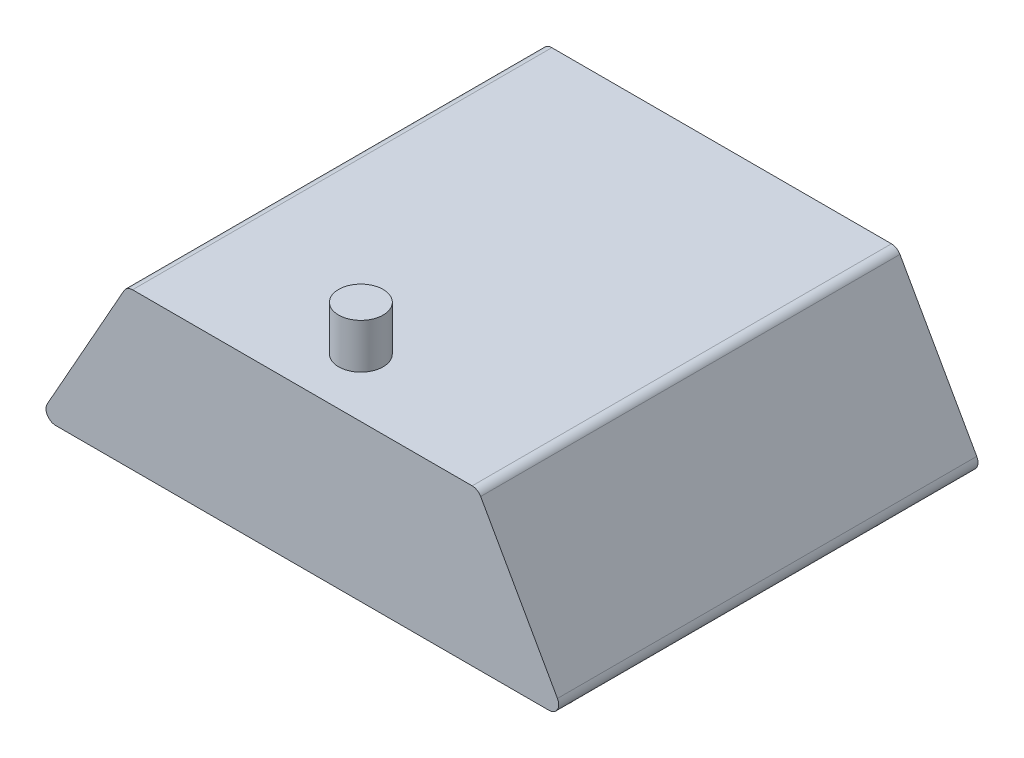
from build123d import *

# Parameters (mm, degrees)
BOSS_EXTRUDE1_DEPTH           = 215
SKETCH2_R                     = 11.405
BOSS_EXTRUDE2_DEPTH           = 20
SKETCH4_R                     = 12.5
BOSS_EXTRUDE3_DEPTH           = 20
BOSS_EXTRUDE3_DRAFT           = 11
BOSS_EXTRUDE3_PROFILE_2_DEPTH = 20
BOSS_EXTRUDE3_PROFILE_2_DRAFT = 11
BOSS_EXTRUDE3_PROFILE_3_DEPTH = 20
BOSS_EXTRUDE3_PROFILE_3_DRAFT = 11
BOSS_EXTRUDE3_PROFILE_4_DEPTH = 20
BOSS_EXTRUDE3_PROFILE_4_DRAFT = 11
SKETCH5_R                     = 11.405
BOSS_EXTRUDE4_DEPTH           = 3


with BuildPart() as part:
    # Sketch1 → Boss-Extrude1 (new body)
    with BuildSketch(Plane.XY):
        with BuildLine():
            Line((-126.450762578, -40), (126.450762578, -40))
            ThreePointArc((126.450762578, -40), (130.766810017, -37.524229487), (130.808640264, -32.548693802))
            Line((130.808640264, -32.548693802), (91.433640264, 37.451306198))
            ThreePointArc((91.433640264, 37.451306198), (89.599992065, 39.316047439), (87.075762578, 40))
            Line((87.075762578, 40), (-87.075762578, 40))
            ThreePointArc((-87.075762578, 40), (-89.599992065, 39.316047439), (-91.433640264, 37.451306198))
            Line((-91.433640264, 37.451306198), (-130.808640264, -32.548693802))
            ThreePointArc((-130.808640264, -32.548693802), (-130.766810017, -37.524229487), (-126.450762578, -40))
        make_face()
    extrude(amount=BOSS_EXTRUDE1_DEPTH)

    # Sketch2 → Boss-Extrude2 (add)
    with BuildSketch(Plane(origin=(0, 40, 0), x_dir=(1, 0, 0), z_dir=(0, 1, 0))):
        with Locations(Location((0, -185, 0), (0, 0, 90))):
            Circle(SKETCH2_R)
    extrude(amount=BOSS_EXTRUDE2_DEPTH)


with BuildPart() as boss_extrude3_tool:
    # Sketch4 → Boss-Extrude3 (with draft: the straight prism first)
    with BuildSketch(Plane.XZ.offset(40)):
        with Locations((-100, 185.99)):
            Circle(SKETCH4_R)
    extrude(amount=BOSS_EXTRUDE3_DEPTH)
    # Boss-Extrude3: the draft: its side faces are tilted about the plane it starts from
    boss_extrude3_sides = [boss_extrude3_tool.faces().sort_by_distance(p)[0] for p in [
        (-112.5, -50, 185.99),
    ]]
    draft(boss_extrude3_sides, Plane.XZ.offset(40), BOSS_EXTRUDE3_DRAFT)


with BuildPart() as part_1:
    add(part.part)

    # Boss-Extrude3: add boss_extrude3_tool
    add(boss_extrude3_tool.part)


with BuildPart() as boss_extrude3_profile_2_tool:
    # Sketch4 → Boss-Extrude3 profile 2 (with draft: the straight prism first)
    with BuildSketch(Plane.XZ.offset(40)):
        with Locations((100, 185.99)):
            Circle(SKETCH4_R)
    extrude(amount=BOSS_EXTRUDE3_PROFILE_2_DEPTH)
    # Boss-Extrude3 profile 2: the draft: its side faces are tilted about the plane it starts from
    boss_extrude3_profile_2_sides = [boss_extrude3_profile_2_tool.faces().sort_by_distance(p)[0] for p in [
        (87.5, -50, 185.99),
    ]]
    draft(boss_extrude3_profile_2_sides, Plane.XZ.offset(40), BOSS_EXTRUDE3_PROFILE_2_DRAFT)


with BuildPart() as part_2:
    add(part_1.part)

    # Boss-Extrude3 profile 2: add boss_extrude3_profile_2_tool
    add(boss_extrude3_profile_2_tool.part)


with BuildPart() as boss_extrude3_profile_3_tool:
    # Sketch4 → Boss-Extrude3 profile 3 (with draft: the straight prism first)
    with BuildSketch(Plane.XZ.offset(40)):
        with Locations((100, 29.01)):
            Circle(SKETCH4_R)
    extrude(amount=BOSS_EXTRUDE3_PROFILE_3_DEPTH)
    # Boss-Extrude3 profile 3: the draft: its side faces are tilted about the plane it starts from
    boss_extrude3_profile_3_sides = [boss_extrude3_profile_3_tool.faces().sort_by_distance(p)[0] for p in [
        (87.5, -50, 29.01),
    ]]
    draft(boss_extrude3_profile_3_sides, Plane.XZ.offset(40), BOSS_EXTRUDE3_PROFILE_3_DRAFT)


with BuildPart() as part_3:
    add(part_2.part)

    # Boss-Extrude3 profile 3: add boss_extrude3_profile_3_tool
    add(boss_extrude3_profile_3_tool.part)


with BuildPart() as boss_extrude3_profile_4_tool:
    # Sketch4 → Boss-Extrude3 profile 4 (with draft: the straight prism first)
    with BuildSketch(Plane.XZ.offset(40)):
        with Locations((-100, 29.01)):
            Circle(SKETCH4_R)
    extrude(amount=BOSS_EXTRUDE3_PROFILE_4_DEPTH)
    # Boss-Extrude3 profile 4: the draft: its side faces are tilted about the plane it starts from
    boss_extrude3_profile_4_sides = [boss_extrude3_profile_4_tool.faces().sort_by_distance(p)[0] for p in [
        (-112.5, -50, 29.01),
    ]]
    draft(boss_extrude3_profile_4_sides, Plane.XZ.offset(40), BOSS_EXTRUDE3_PROFILE_4_DRAFT)


with BuildPart() as part_4:
    add(part_3.part)

    # Boss-Extrude3 profile 4: add boss_extrude3_profile_4_tool
    add(boss_extrude3_profile_4_tool.part)

    # Sketch5 → Boss-Extrude4 (add)
    with BuildSketch(Plane(origin=(0, 60, 0), x_dir=(1, 0, 0), z_dir=(0, 1, 0))):
        with Locations(Location((0, -185, 0), (0, 0, 90))):
            Circle(SKETCH5_R)
    extrude(amount=BOSS_EXTRUDE4_DEPTH)


solid = part_4.part
